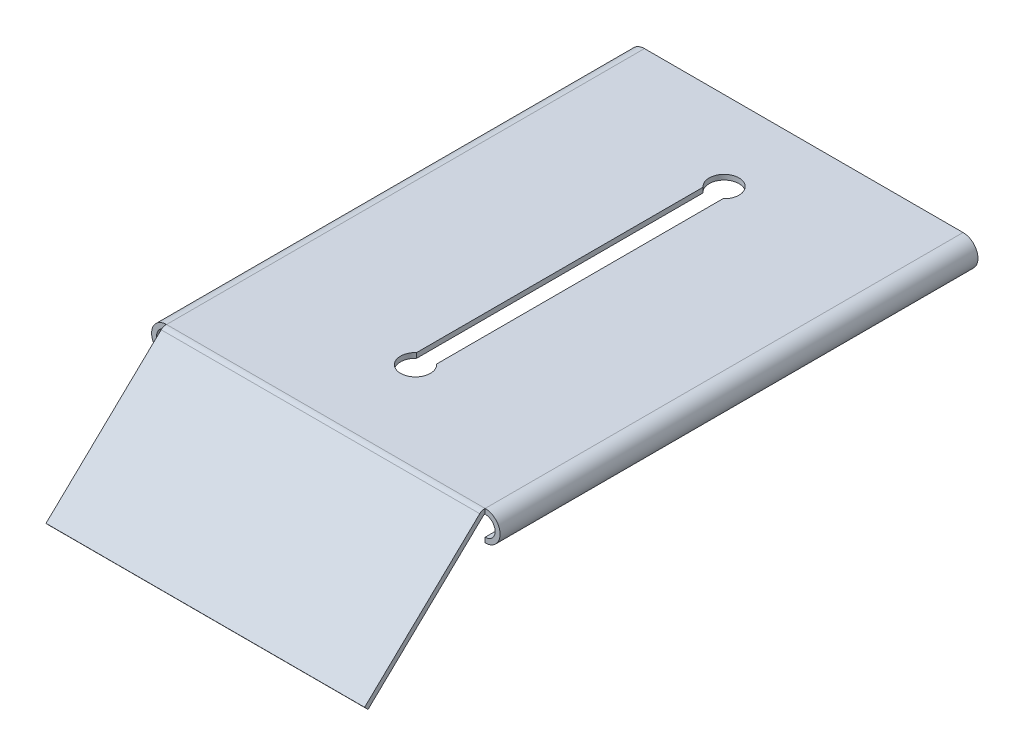
from build123d import *

# Parameters (mm, degrees)
EXTRUDE_THIN1_DEPTH = 152.4
CUT_EXTRUDE1_DEPTH  = 187.089943391
BOSS_EXTRUDE1_DEPTH = 101.6


with BuildPart() as part:
    # Sketch1 → Extrude-Thin1 (new body)
    with BuildSketch(Plane.XY):
        with BuildLine():
            ThreePointArc((0, -6.35), (3.175, -3.175), (0, 0))
            Line((0, 0), (-101.6, 0))
            ThreePointArc((-101.6, 0), (-104.775, -3.175), (-101.6, -6.35))
            Line((-101.6, -6.35), (-101.6, -7.9375))
            ThreePointArc((-101.6, -7.9375), (-106.3625, -3.175), (-101.6, 1.5875))
            Line((-101.6, 1.5875), (0, 1.5875))
            ThreePointArc((0, 1.5875), (4.7625, -3.175), (0, -7.9375))
            Line((0, -7.9375), (0, -6.35))
        make_face()
    extrude(amount=EXTRUDE_THIN1_DEPTH)

    # Sketch3 → Cut-Extrude1 (cut, through all)
    with BuildSketch(Plane(origin=(0, 1.5875, 0), x_dir=(1, 0, 0), z_dir=(0, 1, 0))):
        with BuildLine():
            Line((-53.975, -120.275242086), (-53.975, -28.949757914))
            ThreePointArc((-53.975, -28.949757914), (-50.8, -20.6375), (-47.625, -28.949757914))
            Line((-47.625, -28.949757914), (-47.625, -120.275242086))
            ThreePointArc((-47.625, -120.275242086), (-50.8, -128.5875), (-53.975, -120.275242086))
        make_face()
    extrude(amount=-CUT_EXTRUDE1_DEPTH, mode=Mode.SUBTRACT)

    # Sketch4 → Boss-Extrude1 (add)
    with BuildSketch(Plane(origin=(0, 0, 0), x_dir=(0, 0, -1), z_dir=(1, 0, 0))):
        with BuildLine():
            Line((-154.126058809, 0.997401867), (-190.844208608, -34.108402144))
            Line((-190.844208608, -34.108402144), (-189.747152233, -35.255844326))
            Line((-189.747152233, -35.255844326), (-153.029002434, -0.150040314))
            ThreePointArc((-153.029002434, -0.150040314), (-152.734811746, 0.010126107), (-152.4, 0))
            Line((-152.4, 0), (-152.4, 1.5875))
            ThreePointArc((-152.4, 1.5875), (-153.32800726, 1.482513557), (-154.126058809, 0.997401867))
        make_face()
    extrude(amount=-BOSS_EXTRUDE1_DEPTH)


solid = part.part
